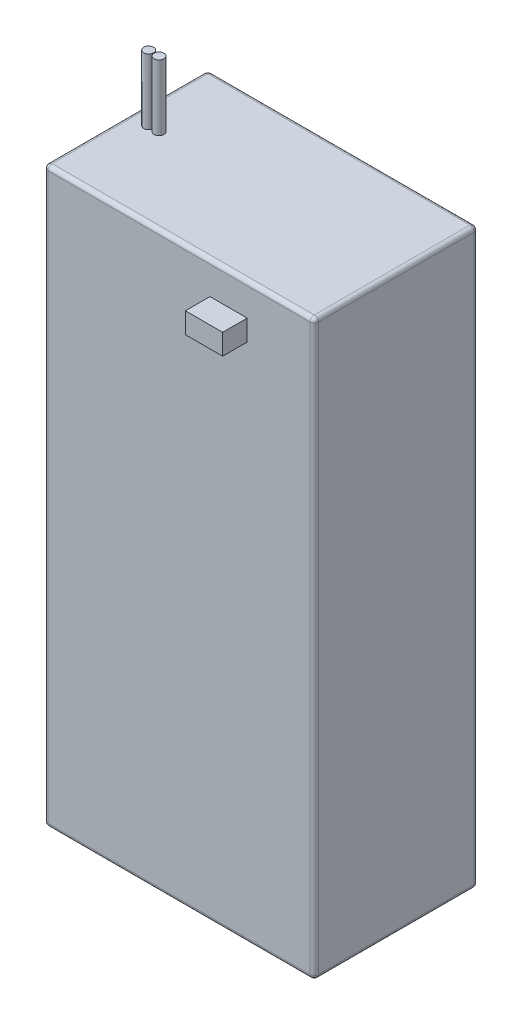
from build123d import *

# Parameters (mm, degrees)
SKETCH1_W           = 33
SKETCH1_H           = 70
BOSS_EXTRUDE1_DEPTH = 20
FILLET1_R           = 0.5
SKETCH2_R           = 0.6
WIRES_2_DEPTH       = 8
SKETCH3_W           = 4.550623551
SKETCH3_H           = 2.528124195
POWER_SWITCH_DEPTH  = 3


with BuildPart() as part:
    # Sketch1 → Boss-Extrude1 (new body)
    with BuildSketch(Plane.XY):
        Rectangle(SKETCH1_W, SKETCH1_H)
    extrude(amount=BOSS_EXTRUDE1_DEPTH)

    # Fillet1
    fillet1_edges = [part.edges().sort_by_distance(p)[0] for p in [
        (-16.5, 0, 20),
        (0, -35, 20),
        (16.5, 0, 20),
        (0, -35, 0),
        (-16.5, 0, 0),
        (0, 35, 0),
        (16.5, 0, 0),
        (16.5, -35, 10),
        (-16.5, -35, 10),
        (-16.5, 35, 10),
        (16.5, 35, 10),
        (0, 35, 20),
    ]]
    fillet(fillet1_edges, radius=FILLET1_R)

    # Sketch2 → Wires 2 (add)
    with BuildSketch(Plane(origin=(0, 35, 0), x_dir=(1, 0, 0), z_dir=(0, 1, 0))):
        with Locations(Location((-14.124921584, -9.591772622, 0), (0, 0, 90))):
            Circle(SKETCH2_R)
        with Locations(Location((-12.864771316, -9.591772622, 0), (0, 0, 90))):
            Circle(SKETCH2_R)
    extrude(amount=WIRES_2_DEPTH)

    # Sketch3 → Power Switch (add)
    with BuildSketch(Plane.XY.offset(20)):
        with Locations((6.042216827, 29.812148032)):
            Rectangle(SKETCH3_W, SKETCH3_H)
    extrude(amount=POWER_SWITCH_DEPTH)


solid = part.part
